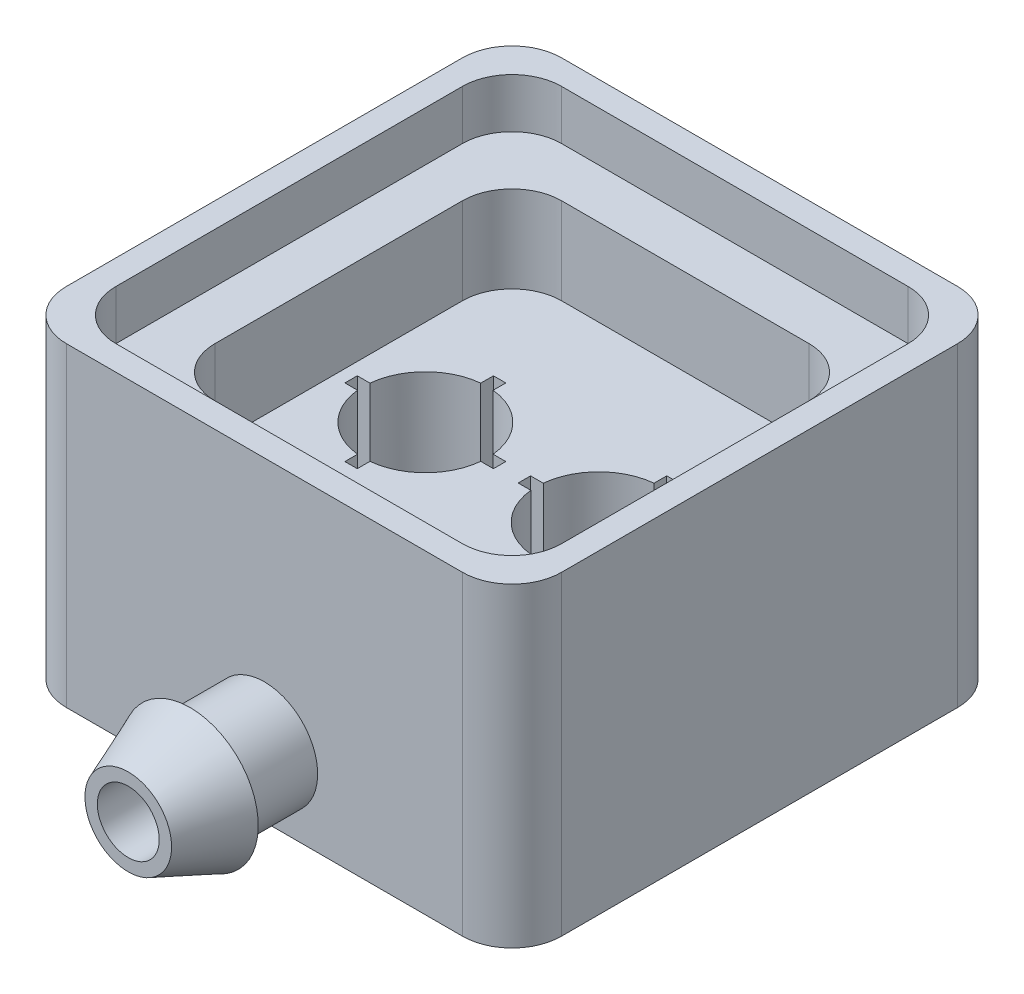
from build123d import *

# Parameters (mm, degrees)
SKETCH1_R           = 2.5
BOSS_EXTRUDE1_DEPTH = 7.23
CUT_EXTRUDE1_START  = -6.43
CUT_EXTRUDE1_DEPTH  = 6.43
CUT_EXTRUDE2_START  = -13
SKETCH5_R           = 1.25
CUT_EXTRUDE2_DEPTH  = 13
BOSS_EXTRUDE2_DEPTH = 3.5
BOSS_EXTRUDE3_DEPTH = 2


with BuildPart() as part:
    # Sketch1 → Boss-Extrude1 (new body)
    with BuildSketch(Plane(origin=(0, 0, 0), x_dir=(1, 0, 0), z_dir=(0, 1, 0))):
        with BuildLine():
            Line((-8, -10), (8, -10))
            ThreePointArc((8, -10), (9.414213562, -9.414213562), (10, -8))
            Line((10, -8), (10, 8))
            ThreePointArc((10, 8), (9.414213562, 9.414213562), (8, 10))
            Line((8, 10), (-8, 10))
            ThreePointArc((-8, 10), (-9.414213562, 9.414213562), (-10, 8))
            Line((-10, 8), (-10, -8))
            ThreePointArc((-10, -8), (-9.414213562, -9.414213562), (-8, -10))
        make_face()
        with Locations(Location((3.5, 0, 0), (0, 0, 270))):
            Circle(SKETCH1_R, mode=Mode.SUBTRACT)
        with Locations(Location((-3.5, 0, 0), (0, 0, 270))):
            Circle(SKETCH1_R, mode=Mode.SUBTRACT)
    extrude(amount=BOSS_EXTRUDE1_DEPTH)

    # Sketch2 → Cut-Extrude1 (cut)
    with BuildSketch(Plane(origin=(0, 7.23, 0), x_dir=(1, 0, 0), z_dir=(0, 1, 0)).offset(CUT_EXTRUDE1_START)):
        with BuildLine():
            Line((3.25, 3), (3.25, 2.487468593))
            ThreePointArc((3.25, 2.487468593), (3.5, 2.5), (3.75, 2.487468593))
            Line((3.75, 2.487468593), (3.75, 3))
            Line((3.75, 3), (3.25, 3))
        make_face()
        with BuildLine():
            ThreePointArc((6, 0), (5.996865183, -0.125156938), (5.987468593, -0.25))
            Line((5.987468593, -0.25), (6.5, -0.25))
            Line((6.5, -0.25), (6.5, 0.25))
            Line((6.5, 0.25), (5.987468593, 0.25))
            ThreePointArc((5.987468593, 0.25), (5.996865183, 0.125156938), (6, 0))
        make_face()
        with BuildLine():
            Line((3.25, -2.487468593), (3.25, -3))
            Line((3.25, -3), (3.75, -3))
            Line((3.75, -3), (3.75, -2.487468593))
            ThreePointArc((3.75, -2.487468593), (3.5, -2.5), (3.25, -2.487468593))
        make_face()
        with BuildLine():
            Line((0.5, -0.25), (1.012531407, -0.25))
            ThreePointArc((1.012531407, -0.25), (1, 0), (1.012531407, 0.25))
            Line((1.012531407, 0.25), (0.5, 0.25))
            Line((0.5, 0.25), (0.5, -0.25))
        make_face()
        with BuildLine():
            ThreePointArc((-1, 0), (-1.003134817, -0.125156938), (-1.012531407, -0.25))
            Line((-1.012531407, -0.25), (-0.5, -0.25))
            Line((-0.5, -0.25), (-0.5, 0.25))
            Line((-0.5, 0.25), (-1.012531407, 0.25))
            ThreePointArc((-1.012531407, 0.25), (-1.003134817, 0.125156938), (-1, 0))
        make_face()
        with BuildLine():
            Line((-3.75, 3), (-3.75, 2.487468593))
            ThreePointArc((-3.75, 2.487468593), (-3.5, 2.5), (-3.25, 2.487468593))
            Line((-3.25, 2.487468593), (-3.25, 3))
            Line((-3.25, 3), (-3.75, 3))
        make_face()
        with BuildLine():
            Line((-6.5, 0.25), (-6.5, -0.25))
            Line((-6.5, -0.25), (-5.987468593, -0.25))
            ThreePointArc((-5.987468593, -0.25), (-6, 0), (-5.987468593, 0.25))
            Line((-5.987468593, 0.25), (-6.5, 0.25))
        make_face()
        with BuildLine():
            ThreePointArc((-3.25, -2.487468593), (-3.5, -2.5), (-3.75, -2.487468593))
            Line((-3.75, -2.487468593), (-3.75, -3))
            Line((-3.75, -3), (-3.25, -3))
            Line((-3.25, -3), (-3.25, -2.487468593))
        make_face()
    extrude(amount=CUT_EXTRUDE1_DEPTH, mode=Mode.SUBTRACT)

    # Sketch3 → Revolve1 (revolve)
    with BuildSketch(Plane(origin=(0, 0, 0), x_dir=(0, 0, -1), z_dir=(1, 0, 0)), mode=Mode.PRIVATE) as revolve1_sk:
        Polygon((-10, 0.6), (-13, 0.6), (-13, 0), (-15.5, 1), (-15.5, 1.5), (-10, 1.5), align=None)
    revolve(revolve1_sk.sketch.rotate(Axis((0, 2.75, 10), (0, 0, 1)), 180), axis=Axis((0, 2.75, 10), (0, 0, 1)))

    # Sketch5 → Cut-Extrude2 (cut)
    with BuildSketch(Plane.XY.offset(10).offset(CUT_EXTRUDE2_START)):
        with Locations(Location((0, 2.75, 0), (0, 0, 90))):
            Circle(SKETCH5_R)
    extrude(amount=CUT_EXTRUDE2_DEPTH, mode=Mode.SUBTRACT)

    # Sketch6 → Boss-Extrude2 (add)
    with BuildSketch(Plane(origin=(0, 7.23, 0), x_dir=(1, 0, 0), z_dir=(0, 1, 0))):
        with BuildLine():
            Line((-8, -10), (8, -10))
            ThreePointArc((8, -10), (9.414213562, -9.414213562), (10, -8))
            Line((10, -8), (10, 8))
            ThreePointArc((10, 8), (9.414213562, 9.414213562), (8, 10))
            Line((8, 10), (-8, 10))
            ThreePointArc((-8, 10), (-9.414213562, 9.414213562), (-10, 8))
            Line((-10, 8), (-10, -8))
            ThreePointArc((-10, -8), (-9.414213562, -9.414213562), (-8, -10))
        make_face()
        with BuildLine():
            Line((-5, -7), (5, -7))
            ThreePointArc((5, -7), (6.414213562, -6.414213562), (7, -5))
            Line((7, -5), (7, 5))
            ThreePointArc((7, 5), (6.414213562, 6.414213562), (5, 7))
            Line((5, 7), (-5, 7))
            ThreePointArc((-5, 7), (-6.414213562, 6.414213562), (-7, 5))
            Line((-7, 5), (-7, -5))
            ThreePointArc((-7, -5), (-6.414213562, -6.414213562), (-5, -7))
        make_face(mode=Mode.SUBTRACT)
    extrude(amount=BOSS_EXTRUDE2_DEPTH)

    # Sketch8 → Boss-Extrude3 (add)
    with BuildSketch(Plane(origin=(0, 10.73, 0), x_dir=(1, 0, 0), z_dir=(0, 1, 0))):
        with BuildLine():
            Line((-8, -10), (8, -10))
            ThreePointArc((8, -10), (9.414213562, -9.414213562), (10, -8))
            Line((10, -8), (10, 8))
            ThreePointArc((10, 8), (9.414213562, 9.414213562), (8, 10))
            Line((8, 10), (-8, 10))
            ThreePointArc((-8, 10), (-9.414213562, 9.414213562), (-10, 8))
            Line((-10, 8), (-10, -8))
            ThreePointArc((-10, -8), (-9.414213562, -9.414213562), (-8, -10))
        make_face()
        with BuildLine():
            Line((-7, -9), (7, -9))
            ThreePointArc((7, -9), (8.414213562, -8.414213562), (9, -7))
            Line((9, -7), (9, 7))
            ThreePointArc((9, 7), (8.414213562, 8.414213562), (7, 9))
            Line((7, 9), (-7, 9))
            ThreePointArc((-7, 9), (-8.414213562, 8.414213562), (-9, 7))
            Line((-9, 7), (-9, -7))
            ThreePointArc((-9, -7), (-8.414213562, -8.414213562), (-7, -9))
        make_face(mode=Mode.SUBTRACT)
    extrude(amount=BOSS_EXTRUDE3_DEPTH)


solid = part.part
